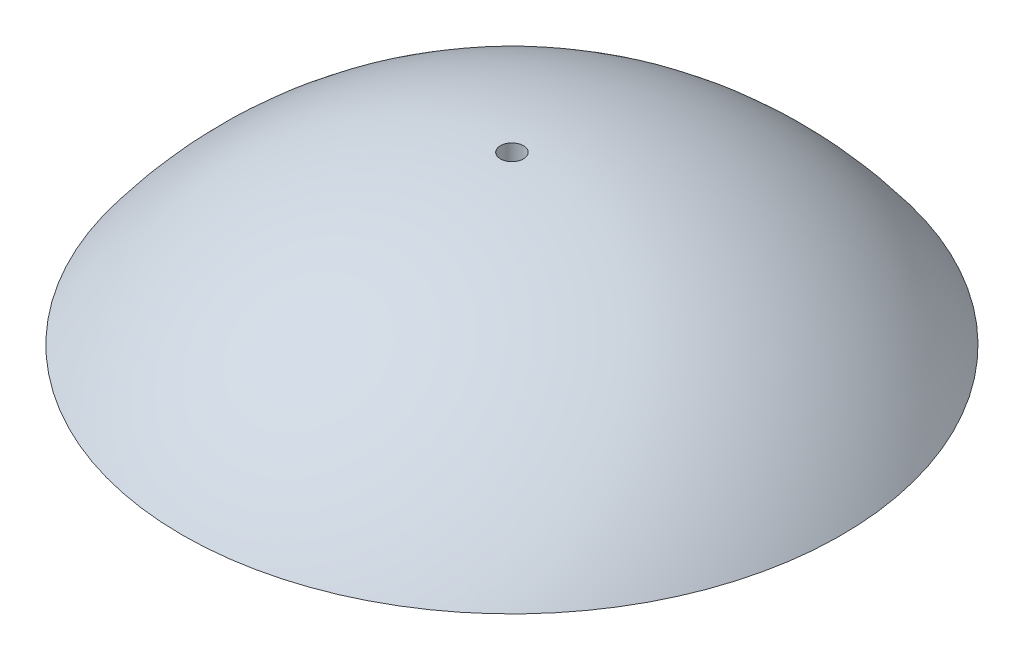
from build123d import *


with BuildPart() as part:
    # Sketch2 → Revolve1 (revolve)
    with BuildSketch(Plane(origin=(0, 0, 0), x_dir=(0, 0, -1), z_dir=(1, 0, 0)), mode=Mode.PRIVATE) as revolve1_sk:
        with BuildLine():
            ThreePointArc((-0.95, 31.785806581), (-14.124641117, 28.490954939), (-24.723268392, 20))
            Line((-24.723268392, 20), (-0.95, 20))
            Line((-0.95, 20), (-0.95, 31.785806581))
        make_face()
        with BuildLine():
            ThreePointArc((-0.95, 33.786646771), (-15.693827277, 29.935660765), (-27.247752201, 20))
            Line((-27.247752201, 20), (-24.723268392, 20))
            ThreePointArc((-24.723268392, 20), (-14.124641117, 28.490954939), (-0.95, 31.785806581))
            Line((-0.95, 31.785806581), (-0.95, 33.786646771))
        make_face()
    revolve(revolve1_sk.sketch.rotate(Axis((0, 0, 0), (0, 1, 0)), 180), axis=Axis((0, 0, 0), (0, 1, 0)))


solid = part.part
